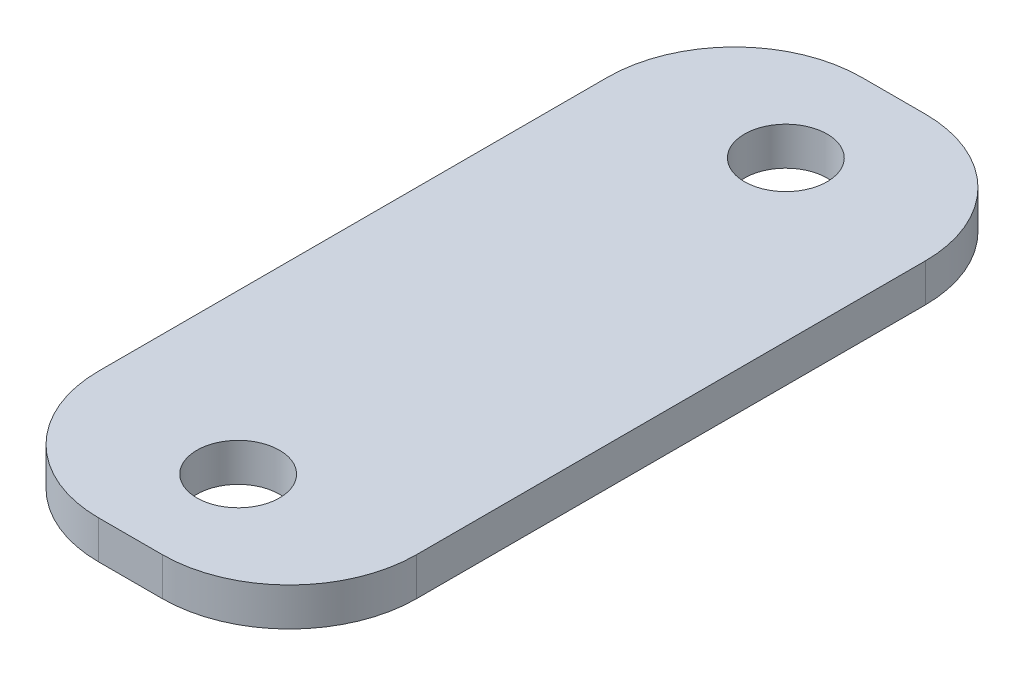
from build123d import *

# Parameters (mm, degrees)
SKETCH_1_W      = 25
SKETCH_1_H      = 60
SKETCH_1_R      = 3.25
EXTRUDE_1_DEPTH = 3
FILLET_1_R      = 10


with BuildPart() as part:
    # 草图1 → 凸台-拉伸1 (new body)
    with BuildSketch(Plane(origin=(0, 0, 0), x_dir=(1, 0, 0), z_dir=(0, 1, 0))):
        Rectangle(SKETCH_1_W, SKETCH_1_H)
        with Locations(Location((0, 21.530596515, 0), (0, 0, 270))):
            Circle(SKETCH_1_R, mode=Mode.SUBTRACT)
        with Locations(Location((0, -21.530596515, 0), (0, 0, 90))):
            Circle(SKETCH_1_R, mode=Mode.SUBTRACT)
    extrude(amount=EXTRUDE_1_DEPTH)

    # 圆角1
    fillet_1_edges = [part.edges().sort_by_distance(p)[0] for p in [
        (12.5, 1.5, 30),
        (-12.5, 1.5, 30),
        (-12.5, 1.5, -30),
        (12.5, 1.5, -30),
    ]]
    fillet(fillet_1_edges, radius=FILLET_1_R)


solid = part.part
